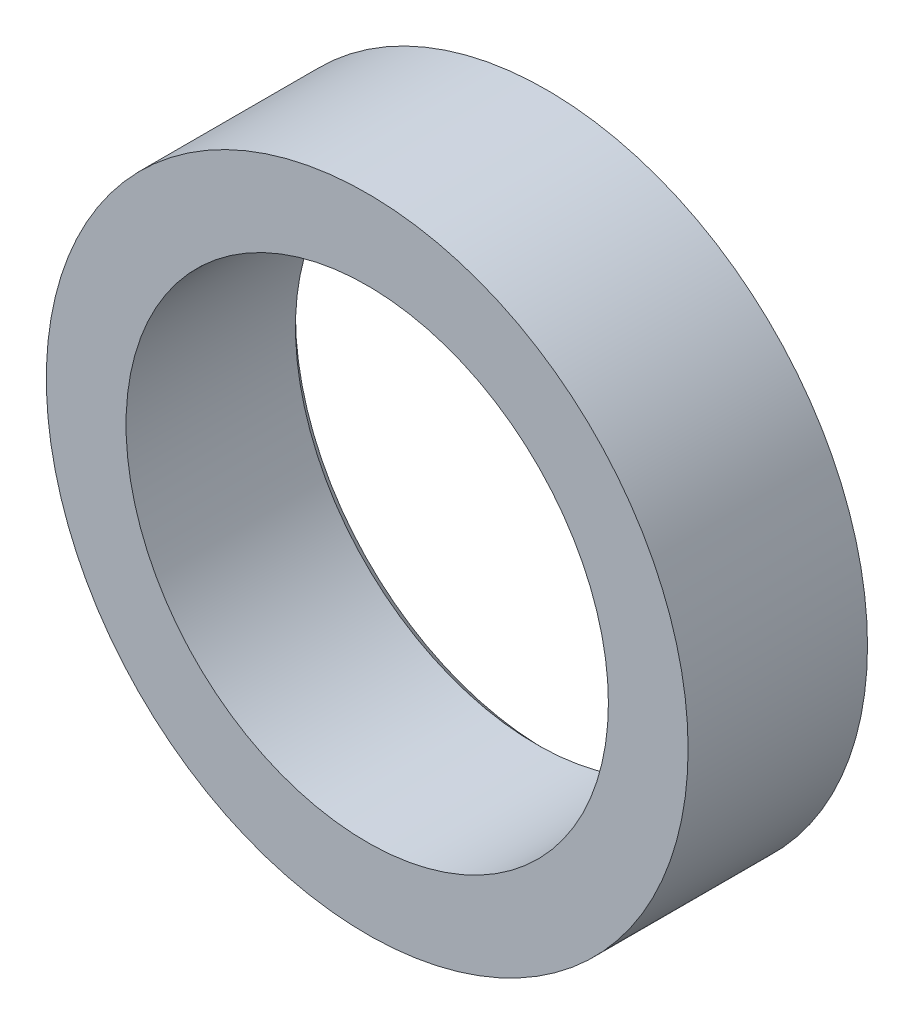
from build123d import *

# Parameters (mm, degrees)
SCHIZZO1_R                   = 16.1
SCHIZZO1_R_2                 = 12.1
ESTRUSIONE_ESTRUSIONE1_DEPTH = 9
SMUSSO1_SIZE                 = 0.5


with BuildPart() as part:
    # Schizzo1 → Estrusione-Estrusione1 (new body)
    with BuildSketch(Plane.XY):
        Circle(SCHIZZO1_R)
        Circle(SCHIZZO1_R_2, mode=Mode.SUBTRACT)
    extrude(amount=ESTRUSIONE_ESTRUSIONE1_DEPTH)

    # Smusso1
    smusso1_edges = [part.edges().sort_by_distance(p)[0] for p in [
        (-12.1, 0, 0),
    ]]
    chamfer(smusso1_edges, length=SMUSSO1_SIZE)


solid = part.part
